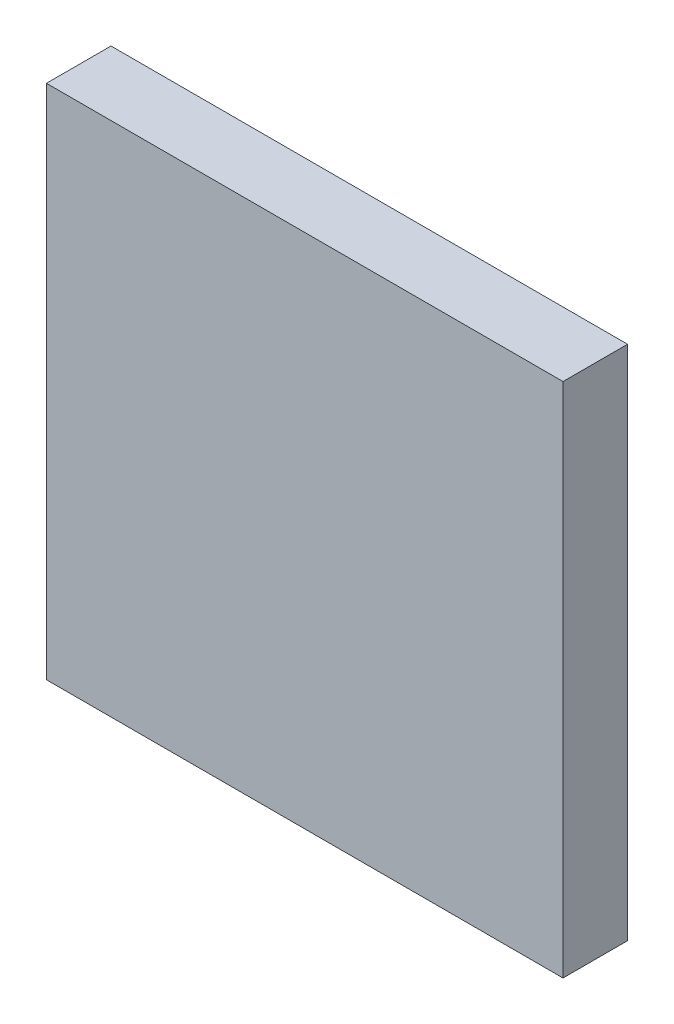
from build123d import *

# Parameters (mm, degrees)
SKETCH1_W           = 25.4
SKETCH1_H           = 25.4
BOSS_EXTRUDE1_DEPTH = 3.175


with BuildPart() as part:
    # Sketch1 → Boss-Extrude1 (new body)
    with BuildSketch(Plane.XY):
        with Locations((-30.583673469, -13.931122449)):
            Rectangle(SKETCH1_W, SKETCH1_H)
    extrude(amount=BOSS_EXTRUDE1_DEPTH)


solid = part.part
